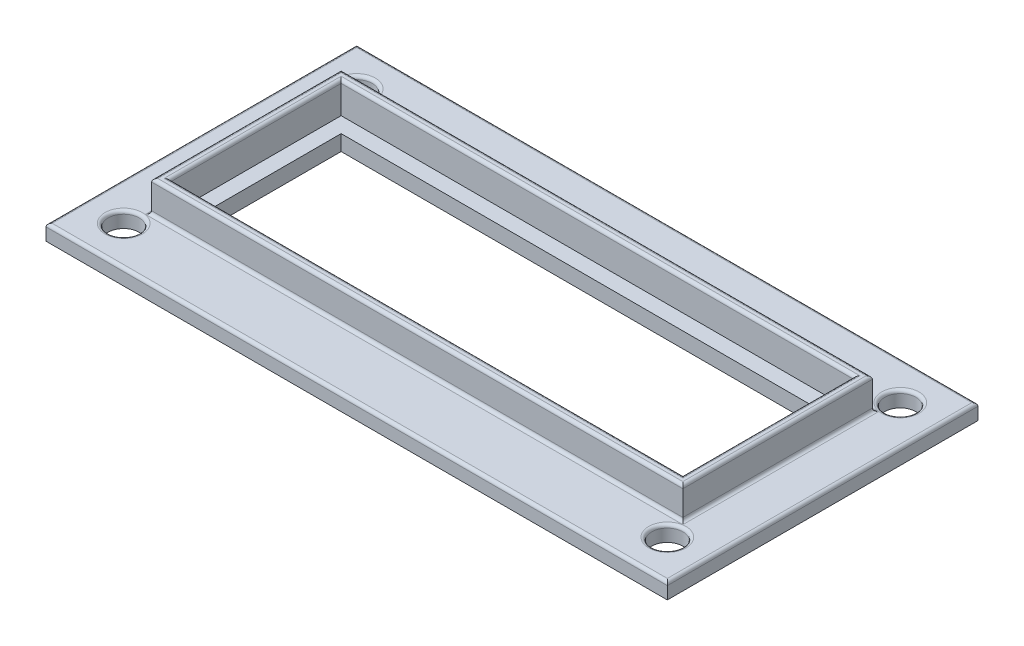
from build123d import *

# Parameters (mm, degrees)
SKETCH1_W               = 171
SKETCH1_H               = 61
SKETCH1_W_2             = 165
SKETCH1_H_2             = 55
BOSS_EXTRUDE1_DEPTH     = 10
SKETCH2_W               = 200
SKETCH2_H               = 100
BOSS_EXTRUDE2_DEPTH     = 5
FILLET1_R               = 1
F_10_0MM_DOWEL_HOLE1_D  = 10
FILLET2_R               = 1
CUT_EXTRUDE2_DEPTH      = 113.249721603
CUT_EXTRUDE2_DEPTH_BACK = 113.249721603
SKETCH5_W               = 155
SKETCH5_H               = 45


with BuildPart() as part:
    # Sketch1 → Boss-Extrude1 (new body)
    with BuildSketch(Plane(origin=(0, 0, 0), x_dir=(1, 0, 0), z_dir=(0, 1, 0))):
        Rectangle(SKETCH1_W, SKETCH1_H)
        Rectangle(SKETCH1_W_2, SKETCH1_H_2, mode=Mode.SUBTRACT)
    extrude(amount=BOSS_EXTRUDE1_DEPTH)

    # Sketch2 → Boss-Extrude2 (add)
    with BuildSketch(Plane(origin=(0, 0, 0), x_dir=(1, 0, 0), z_dir=(0, 1, 0))):
        Rectangle(SKETCH2_W, SKETCH2_H)
    extrude(amount=-BOSS_EXTRUDE2_DEPTH)

    # Fillet1
    fillet1_edges = [part.edges().sort_by_distance(p)[0] for p in [
        (0, 10, 30.5),
        (82.5, 10, 0),
        (85.5, 10, 0),
        (0, 10, -27.5),
        (-82.5, 10, 0),
        (0, 10, 27.5),
        (0, 10, -30.5),
        (-85.5, 10, 0),
    ]]
    fillet(fillet1_edges, radius=FILLET1_R)

    # Ø10.0mm Dowel Hole1 (through all)
    with Locations(Plane(origin=(-87.5, 0, -37.5), x_dir=(0, 0, 1), z_dir=(0, 1, 0))):
        with Locations((0, 0), (0, 175), (75, 175), (75, 0)):
            Hole(F_10_0MM_DOWEL_HOLE1_D / 2)

    # Fillet2
    fillet2_edges = [part.edges().sort_by_distance(p)[0] for p in [
        (100, 0, 0),
        (0, 0, -50),
        (-100, 0, 0),
        (0, 0, 50),
        (85.5, 0, 0),
        (0, 0, 30.5),
        (-85.5, 0, 0),
        (0, 0, -30.5),
        (-87.5, 0, 42.5),
        (87.5, 0, 42.5),
        (87.5, 0, -32.5),
        (-87.5, 0, -32.5),
    ]]
    fillet(fillet2_edges, radius=FILLET2_R)

    # Sketch5 → Cut-Extrude2 (cut, two sides: drawn at the far end of the back side and taken through both)
    with BuildSketch(Plane(origin=(0, 0, 0), x_dir=(1, 0, 0), z_dir=(0, 1, 0)).offset(-CUT_EXTRUDE2_DEPTH_BACK)):
        Rectangle(SKETCH5_W, SKETCH5_H)
    extrude(amount=CUT_EXTRUDE2_DEPTH + CUT_EXTRUDE2_DEPTH_BACK, mode=Mode.SUBTRACT)


solid = part.part
